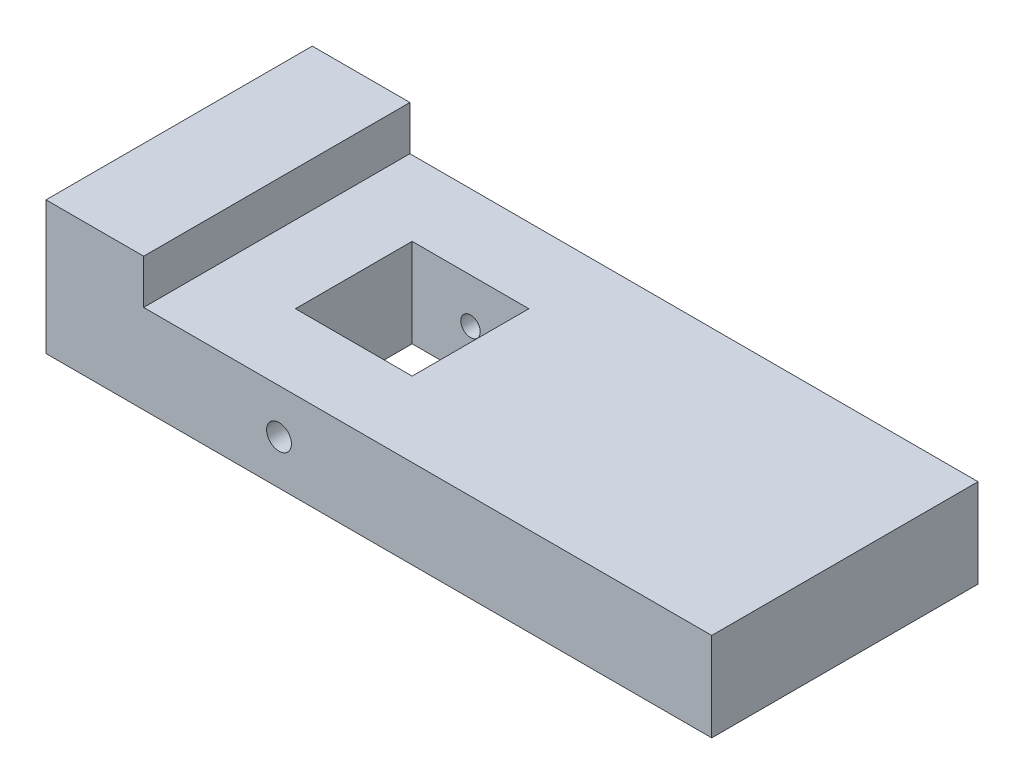
from build123d import *

# Parameters (mm, degrees)
SKETCH1_W           = 150
SKETCH1_H           = 60
BOSS_EXTRUDE1_DEPTH = 20
SKETCH2_W           = 22
SKETCH2_H           = 60
BOSS_EXTRUDE2_DEPTH = 10
SKETCH3_W           = 26.3
SKETCH3_H           = 26.3
CUT_EXTRUDE1_DEPTH  = 84.216584885
SKETCH4_R           = 2.2
CUT_EXTRUDE2_DEPTH  = 101.623058987
SKETCH5_R           = 2.8
CUT_EXTRUDE3_DEPTH  = 6
SKETCH6_R           = 4
CUT_EXTRUDE4_DEPTH  = 2


with BuildPart() as part:
    # Sketch1 → Boss-Extrude1 (new body)
    with BuildSketch(Plane(origin=(0, 0, 0), x_dir=(1, 0, 0), z_dir=(0, 1, 0))):
        Rectangle(SKETCH1_W, SKETCH1_H)
    extrude(amount=BOSS_EXTRUDE1_DEPTH)

    # Sketch2 → Boss-Extrude2 (add)
    with BuildSketch(Plane(origin=(0, 20, 0), x_dir=(1, 0, 0), z_dir=(0, 1, 0))):
        with Locations((-64, 0)):
            Rectangle(SKETCH2_W, SKETCH2_H)
    extrude(amount=BOSS_EXTRUDE2_DEPTH)

    # Sketch3 → Cut-Extrude1 (cut, through all)
    with BuildSketch(Plane(origin=(0, 20, 0), x_dir=(1, 0, 0), z_dir=(0, 1, 0))):
        with Locations((-22.5, 0)):
            Rectangle(SKETCH3_W, SKETCH3_H)
    extrude(amount=-CUT_EXTRUDE1_DEPTH, mode=Mode.SUBTRACT)

    # Sketch4 → Cut-Extrude2 (cut, through all)
    with BuildSketch(Plane.XY.offset(30)):
        with Locations((-22.5, 10)):
            Circle(SKETCH4_R)
    extrude(amount=-CUT_EXTRUDE2_DEPTH, mode=Mode.SUBTRACT)

    # Sketch5 → Cut-Extrude3 (cut)
    with BuildSketch(Plane.XY.offset(30)):
        with Locations((-22.5, 10)):
            Circle(SKETCH5_R)
    extrude(amount=-CUT_EXTRUDE3_DEPTH, mode=Mode.SUBTRACT)

    # Sketch6 → Cut-Extrude4 (cut)
    with BuildSketch(Plane(origin=(0, 0, 0), x_dir=(-1, 0, 0), z_dir=(0, -1, 0))):
        with Locations(Location((0, 0, 0), (0, 0, 90))):
            Circle(SKETCH6_R)
        with Locations(Location((-55, 0, 0), (0, 0, 90))):
            Circle(SKETCH6_R)
        with Locations(Location((55, 0, 0), (0, 0, 90))):
            Circle(SKETCH6_R)
    extrude(amount=-CUT_EXTRUDE4_DEPTH, mode=Mode.SUBTRACT)


solid = part.part
